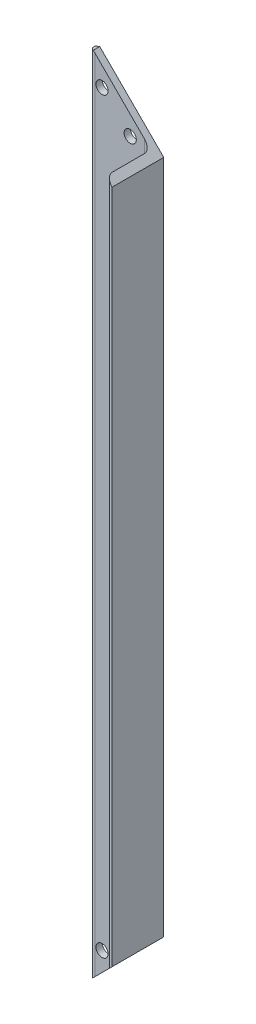
from build123d import *

# Parameters (mm, degrees)
L_ANGLE_L2X1_5X0_1875_1_DEPTH = 600
CUT_EXTRUDE1_REACH            = 308.647
M8_CLEARANCE_HOLE1_D          = 9


with BuildPart() as part:
    # Sketch14 → L angle L2X1.5X0.1875(1) (new body)
    with BuildSketch(Plane(origin=(0, 300, 0), x_dir=(0, 0, 1), z_dir=(0, -1, 0))):
        with BuildLine():
            Line((0, 0), (0, 50.8))
            Line((0, 50.8), (0.00508, 50.8))
            ThreePointArc((0.00508, 50.8), (3.369083943, 49.406583943), (4.7625, 46.04258))
            Line((4.7625, 46.04258), (4.7625, 9.525))
            ThreePointArc((4.7625, 9.525), (6.157403955, 6.157403955), (9.525, 4.7625))
            Line((9.525, 4.7625), (33.34258, 4.7625))
            ThreePointArc((33.34258, 4.7625), (36.706583943, 3.369083943), (38.1, 0.00508))
            Line((38.1, 0.00508), (38.1, 0))
            Line((38.1, 0), (0, 0))
        make_face()
    extrude(amount=L_ANGLE_L2X1_5X0_1875_1_DEPTH)

    # Sketch15 → Cut-Extrude1 (cut, up to next)
    with BuildSketch(Plane.XY, mode=Mode.PRIVATE) as cut_extrude1_sk1:
        Polygon((-50.8, -300), (0, -300), (0, -249.2), (-48.3, -297.5), (-50.8, -295), align=None)
    cut_extrude1_tool1 = extrude(cut_extrude1_sk1.sketch, amount=CUT_EXTRUDE1_REACH, mode=Mode.PRIVATE) & part.part
    # Sketch15 → Cut-Extrude1 (cut, up to next)
    with BuildSketch(Plane.XY, mode=Mode.PRIVATE) as cut_extrude1_sk2:
        Polygon((-50.8, 300), (0, 300), (0, 249.2), (-47.264466094, 296.464466094), (-50.8, 295), align=None)
    cut_extrude1_tool2 = extrude(cut_extrude1_sk2.sketch, amount=CUT_EXTRUDE1_REACH, mode=Mode.PRIVATE) & part.part
    add(cut_extrude1_tool1.solids().sort_by_distance((-17.092568, -283.136241, 0))[0], mode=Mode.SUBTRACT)
    add(cut_extrude1_tool2.solids().sort_by_distance((-17.155727, 283.162516, 0))[0], mode=Mode.SUBTRACT)

    # M8 Clearance Hole1 (through all)
    with Locations(Plane.XY.offset(4.7625)):
        with Locations((-40.8, 275.857864376), (-20.00508, 255.062944376), (-20.00508, -255.062944376), (-40.8, -275.857864376)):
            Hole(M8_CLEARANCE_HOLE1_D / 2)


solid = part.part
